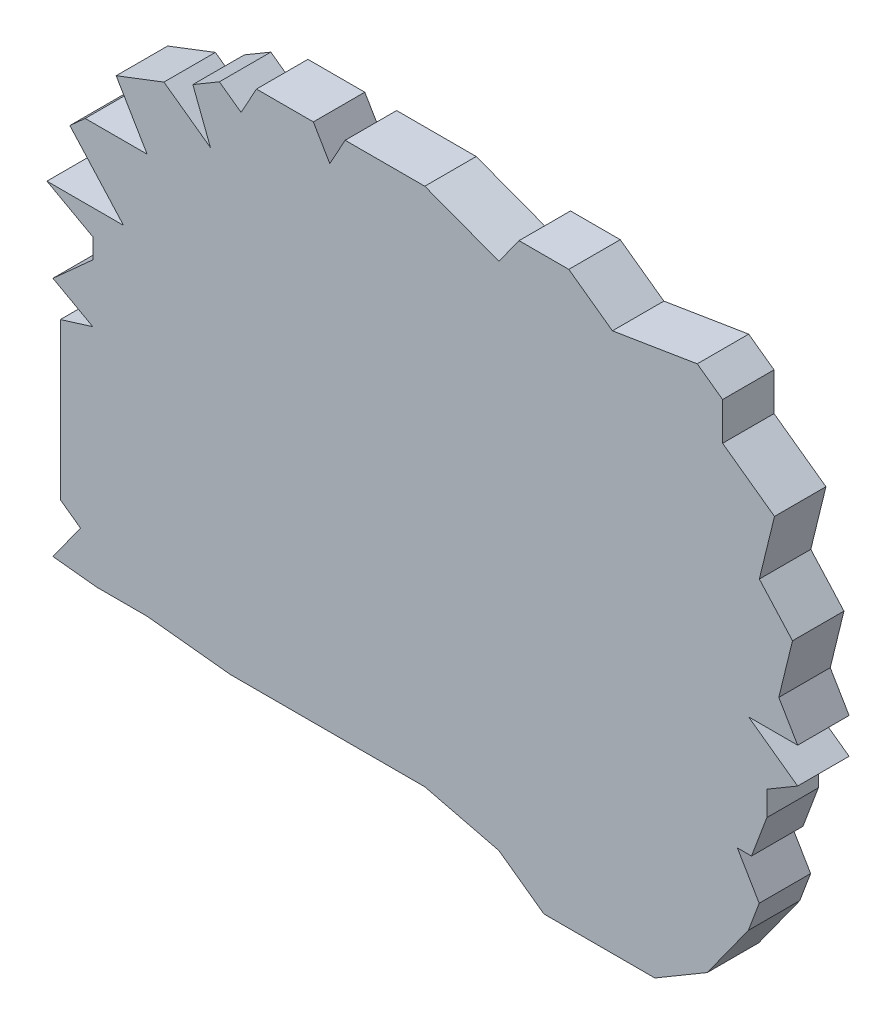
from build123d import *

# Parameters (mm, degrees)
EXTRUDE_1_DEPTH = 10


with BuildPart() as part:
    # Эскиз1 → Бобышка-Вытянуть1 (new body)
    with BuildSketch(Plane.XY):
        Polygon((-66.282586336, 4.09041909), (-74.040470763, 8.357255525), (-70.161528549, 11.848303517), (-66.282586336, 15.339351509), (-66.282586336, 19.218293722), (-75.209365057, 24.128022019), (-60.314226958, 24.128022019), (-70.745975697, 35.71885395), (-67.761796008, 38.40461567), (-55.730109265, 38.40461567), (-61.745952636, 48.606953693), (-52.460988202, 52.175342696), (-43.416291781, 45.665500099), (-46.838743542, 54.570735165), (-41.684369065, 57.610029636), (-37.461610157, 54.570735165), (-34.477282264, 59.996785881), (-23.420274879, 59.996785881), (-20.22078559, 54.570735165), (-17.236457696, 59.996785881), (-1.763387891, 59.996785881), (12.653887704, 54.570735165), (16.559241123, 59.996785881), (26.230185451, 59.996785881), (34.710427131, 53.893204737), (51.197564442, 56.580039943), (56.124240189, 53.034107371), (56.124240189, 45.665500099), (66.212425028, 38.40461567), (63.264526212, 26.381057915), (69.711013986, 19.218293722), (67.048138131, 8.357255525), (70.712863391, 2.142205771), (61.168332609, 2.142205771), (70.712863391, -4.727388317), (64.73847562, -8.250206419), (64.73847562, -13.02813029), (61.735677356, -21.006708523), (58.995962435, -21.006708523), (63.237076488, -28.199262665), (61.116519462, -33.833683844), (53.138381044, -44.918412685), (42.953995786, -50.923670147), (34.710427131, -50.923670147), (21.394713287, -50.923670147), (12.653887704, -44.632535977), (-1.763387891, -41.097752801), (-17.236457696, -41.097752801), (-39.572989611, -41.097752801), (-55.730109265, -39.376048265), (-65.530101327, -39.376048265), (-74.040470763, -38.469182314), (-68.6764474, -31.016473255), (-72.590645655, -28.199262665), (-72.590645655, -19.765075522), (-72.590645655, -11.813243984), (-72.590645655, -8.250206419), (-72.590645655, 2.142205771), align=None)
    extrude(amount=EXTRUDE_1_DEPTH)


solid = part.part
